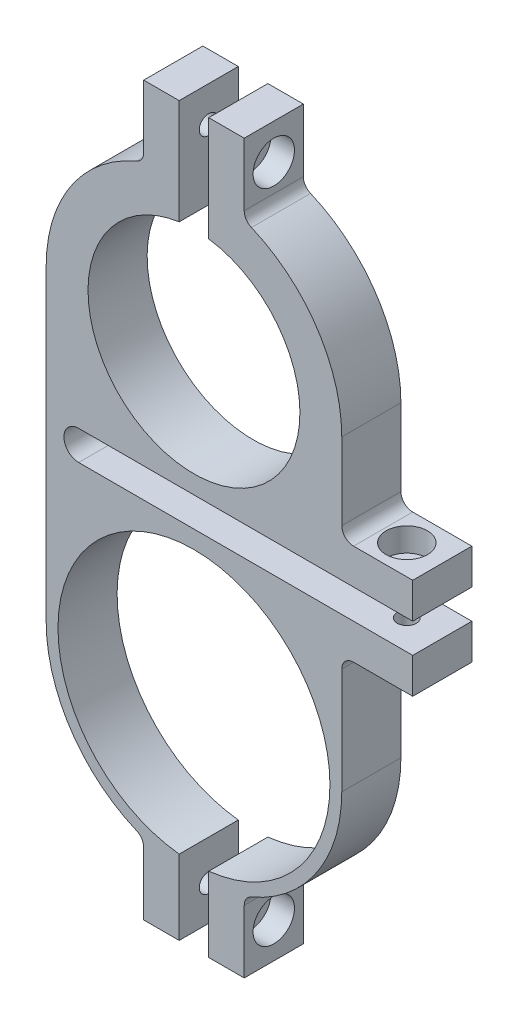
from build123d import *

# Parameters (mm, degrees)
EXTRUDE1_DEPTH                                   = 7.9375
CBORE_FOR_1_4_SOCKET_HEAD_CAP_SCREW1_D           = 6.7564
CBORE_FOR_1_4_SOCKET_HEAD_CAP_SCREW1_DEPTH       = 9.525
CBORE_FOR_1_4_SOCKET_HEAD_CAP_SCREW1_CBORE_D     = 11.1125
CBORE_FOR_1_4_SOCKET_HEAD_CAP_SCREW1_CBORE_DEPTH = 6.35
F_1_4_20_TAPPED_HOLE1_D                          = 5.1054
CBORE_FOR_1_4_SOCKET_HEAD_CAP_SCREW2_D           = 6.7564
CBORE_FOR_1_4_SOCKET_HEAD_CAP_SCREW2_DEPTH       = 9.525
CBORE_FOR_1_4_SOCKET_HEAD_CAP_SCREW2_CBORE_D     = 11.1125
CBORE_FOR_1_4_SOCKET_HEAD_CAP_SCREW2_CBORE_DEPTH = 6.35
F_1_4_20_TAPPED_HOLE3_D                          = 5.1054
CBORE_FOR_1_4_SOCKET_HEAD_CAP_SCREW3_D           = 6.7564
CBORE_FOR_1_4_SOCKET_HEAD_CAP_SCREW3_DEPTH       = 9.525
CBORE_FOR_1_4_SOCKET_HEAD_CAP_SCREW3_CBORE_D     = 11.1125
CBORE_FOR_1_4_SOCKET_HEAD_CAP_SCREW3_CBORE_DEPTH = 6.35
F_1_4_20_TAPPED_HOLE4_D                          = 5.1054
FILLET1_R                                        = 3.175


with BuildPart() as part:
    # Sketch1 → Extrude1 (new, symmetric)
    with BuildSketch(Plane.XY):
        with BuildLine():
            Line((-39.6875, 82.55), (-39.6875, 0))
            ThreePointArc((-39.6875, 0), (-32.485618813, -22.798733003), (-13.49375, -37.323134477))
            Line((-13.49375, -37.323134477), (-13.49375, -56.373134477))
            Line((-13.49375, -56.373134477), (-3.96875, -56.373134477))
            Line((-3.96875, -56.373134477), (-3.96875, -36.296166184))
            ThreePointArc((-3.96875, -36.296166184), (0, 36.5125), (3.96875, -36.296166184))
            Line((3.96875, -36.296166184), (3.96875, -56.373134477))
            Line((3.96875, -56.373134477), (13.49375, -56.373134477))
            Line((13.49375, -56.373134477), (13.49375, -37.323134477))
            ThreePointArc((13.49375, -37.323134477), (32.485618813, -22.798733003), (39.6875, 0))
            Line((39.6875, 0), (39.6875, 31.75))
            Line((39.6875, 31.75), (58.7375, 31.75))
            Line((58.7375, 31.75), (58.7375, 41.275))
            Line((58.7375, 41.275), (-30.95625, 41.275))
            ThreePointArc((-30.95625, 41.275), (-34.925, 45.24375), (-30.95625, 49.2125))
            Line((-30.95625, 49.2125), (58.7375, 49.2125))
            Line((58.7375, 49.2125), (58.7375, 58.7375))
            Line((58.7375, 58.7375), (39.6875, 58.7375))
            Line((39.6875, 58.7375), (39.6875, 82.55))
            ThreePointArc((39.6875, 82.55), (32.485618813, 105.348733003), (13.49375, 119.873134477))
            Line((13.49375, 119.873134477), (13.49375, 138.923134477))
            Line((13.49375, 138.923134477), (3.96875, 138.923134477))
            Line((3.96875, 138.923134477), (3.96875, 110.719801693))
            ThreePointArc((3.96875, 110.719801693), (0, 54.102), (-3.96875, 110.719801693))
            Line((-3.96875, 110.719801693), (-3.96875, 138.923134477))
            Line((-3.96875, 138.923134477), (-13.49375, 138.923134477))
            Line((-13.49375, 138.923134477), (-13.49375, 119.873134477))
            ThreePointArc((-13.49375, 119.873134477), (-32.485618813, 105.348733003), (-39.6875, 82.55))
        make_face()
    extrude(amount=EXTRUDE1_DEPTH, both=True)

    # CBORE for 1/4 Socket Head Cap Screw1
    with Locations(Plane(origin=(13.49375, 0, 0), x_dir=(0, 0, -1), z_dir=(1, 0, 0))):
        with Locations((0, 129.398134477)):
            CounterBoreHole(CBORE_FOR_1_4_SOCKET_HEAD_CAP_SCREW1_D / 2, CBORE_FOR_1_4_SOCKET_HEAD_CAP_SCREW1_CBORE_D / 2, CBORE_FOR_1_4_SOCKET_HEAD_CAP_SCREW1_CBORE_DEPTH, depth=CBORE_FOR_1_4_SOCKET_HEAD_CAP_SCREW1_DEPTH)

    # 1/4-20 Tapped Hole1 (through all)
    with Locations(Plane(origin=(-3.96875, 0, 0), x_dir=(0, 0, -1), z_dir=(1, 0, 0))):
        with Locations((0, 129.398134477)):
            Hole(F_1_4_20_TAPPED_HOLE1_D / 2)

    # CBORE for 1/4 Socket Head Cap Screw2
    with Locations(Plane(origin=(0, 58.7375, 0), x_dir=(0, 0, -1), z_dir=(0, 1, 0))):
        with Locations((0, -49.2125)):
            CounterBoreHole(CBORE_FOR_1_4_SOCKET_HEAD_CAP_SCREW2_D / 2, CBORE_FOR_1_4_SOCKET_HEAD_CAP_SCREW2_CBORE_D / 2, CBORE_FOR_1_4_SOCKET_HEAD_CAP_SCREW2_CBORE_DEPTH, depth=CBORE_FOR_1_4_SOCKET_HEAD_CAP_SCREW2_DEPTH)

    # 1/4-20 Tapped Hole3 (through all)
    with Locations(Plane(origin=(0, 41.275, 0), x_dir=(-1, 0, 0), z_dir=(0, 1, 0))):
        with Locations((-49.2125, 0)):
            Hole(F_1_4_20_TAPPED_HOLE3_D / 2)

    # CBORE for 1/4 Socket Head Cap Screw3
    with Locations(Plane(origin=(13.49375, 0, 0), x_dir=(0, 0, -1), z_dir=(1, 0, 0))):
        with Locations((0, -46.848134477)):
            CounterBoreHole(CBORE_FOR_1_4_SOCKET_HEAD_CAP_SCREW3_D / 2, CBORE_FOR_1_4_SOCKET_HEAD_CAP_SCREW3_CBORE_D / 2, CBORE_FOR_1_4_SOCKET_HEAD_CAP_SCREW3_CBORE_DEPTH, depth=CBORE_FOR_1_4_SOCKET_HEAD_CAP_SCREW3_DEPTH)

    # 1/4-20 Tapped Hole4 (through all)
    with Locations(Plane(origin=(-3.96875, 0, 0), x_dir=(0, 0, -1), z_dir=(1, 0, 0))):
        with Locations((0, -46.848134477)):
            Hole(F_1_4_20_TAPPED_HOLE4_D / 2)

    # Fillet1
    fillet1_edges = [part.edges().sort_by_distance(p)[0] for p in [
        (39.6875, 31.75, 0),
        (13.49375, -37.323134477, 0),
        (-13.49375, -37.323134477, 0),
        (-13.49375, 119.873134477, 0),
        (13.49375, 119.873134477, 0),
        (39.6875, 58.7375, 0),
    ]]
    fillet(fillet1_edges, radius=FILLET1_R)


solid = part.part
